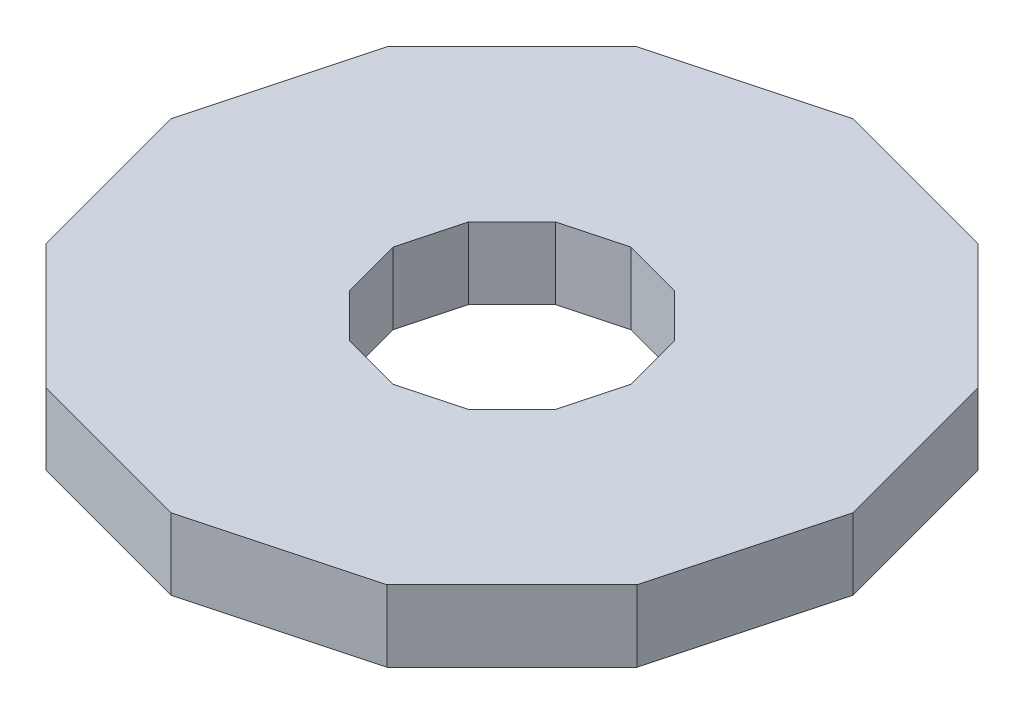
from build123d import *

# Parameters (mm, degrees)
BOSS_EXTRUDE1_DEPTH = 19.05


with BuildPart() as part:
    # Sketch1 → Boss-Extrude1 (new body)
    with BuildSketch(Plane(origin=(0, 0, 0), x_dir=(1, 0, 0), z_dir=(0, 1, 0))):
        Polygon((90.777709155, 0), (78.615802225, 45.388854577), (45.388854577, 78.615802225), (0, 90.777709155), (-45.388854577, 78.615802225), (-78.615802225, 45.388854577), (-90.777709155, 0), (-78.615802225, -45.388854577), (-45.388854577, -78.615802225), (0, -90.777709155), (45.388854577, -78.615802225), (78.615802225, -45.388854577), align=None)
        Polygon((31.611675444, 0), (27.376513991, 15.805837722), (15.805837722, 27.376513991), (0, 31.611675444), (-15.805837722, 27.376513991), (-27.376513991, 15.805837722), (-31.611675444, 0), (-27.376513991, -15.805837722), (-15.805837722, -27.376513991), (0, -31.611675444), (15.805837722, -27.376513991), (27.376513991, -15.805837722), align=None, mode=Mode.SUBTRACT)
    extrude(amount=BOSS_EXTRUDE1_DEPTH)


solid = part.part
